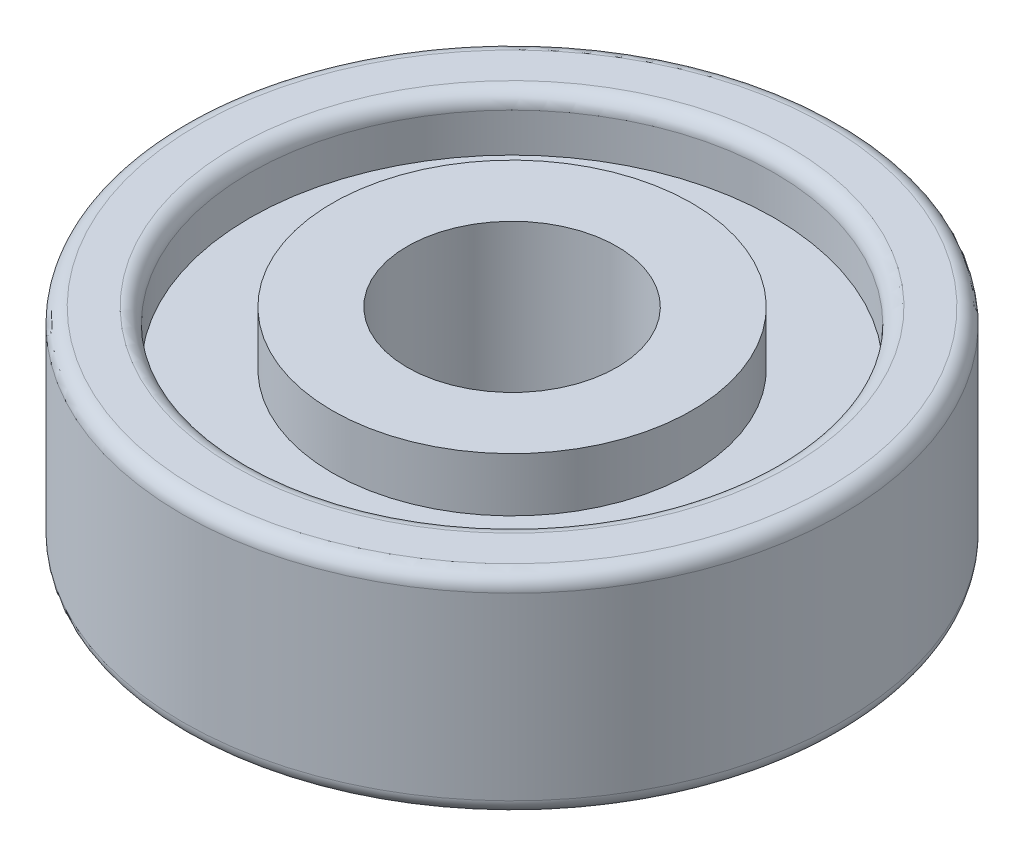
from build123d import *

# Parameters (mm, degrees)
SKETCH1_R           = 11
BOSS_EXTRUDE1_DEPTH = 3.5
SKETCH2_R           = 3.5
CUT_EXTRUDE1_DEPTH  = 18.058722109
SKETCH2_6_R         = 8.75
SKETCH2_6_R_2       = 6
CUT_EXTRUDE2_DEPTH  = 1.8
FILLET1_R           = 0.5


with BuildPart() as part:
    # Sketch1 → Boss-Extrude1 (new, symmetric)
    with BuildSketch(Plane(origin=(0, 0, 0), x_dir=(1, 0, 0), z_dir=(0, 1, 0))):
        Circle(SKETCH1_R)
    extrude(amount=BOSS_EXTRUDE1_DEPTH, both=True)

    # Sketch2 → Cut-Extrude1 (cut, through all)
    with BuildSketch(Plane(origin=(0, 3.5, 0), x_dir=(1, 0, 0), z_dir=(0, 1, 0))):
        Circle(SKETCH2_R)
    extrude(amount=-CUT_EXTRUDE1_DEPTH, mode=Mode.SUBTRACT)

    # Sketch2<6> → Cut-Extrude2 (cut)
    with BuildSketch(Plane(origin=(0, 3.5, 0), x_dir=(1, 0, 0), z_dir=(0, 1, 0))):
        Circle(SKETCH2_6_R)
        Circle(SKETCH2_6_R_2, mode=Mode.SUBTRACT)
    cut_extrude2 = extrude(amount=-CUT_EXTRUDE2_DEPTH, mode=Mode.SUBTRACT)

    # Mirror1: Cut-Extrude2 across plane
    add(cut_extrude2.mirror(Plane.ZX), mode=Mode.SUBTRACT)

    # Fillet1
    fillet1_edges = [part.edges().sort_by_distance(p)[0] for p in [
        (-11, 3.5, 0),
        (-11, -3.5, 0),
        (-8.75, -3.5, 0),
        (-8.75, 3.5, 0),
    ]]
    fillet(fillet1_edges, radius=FILLET1_R)


solid = part.part
